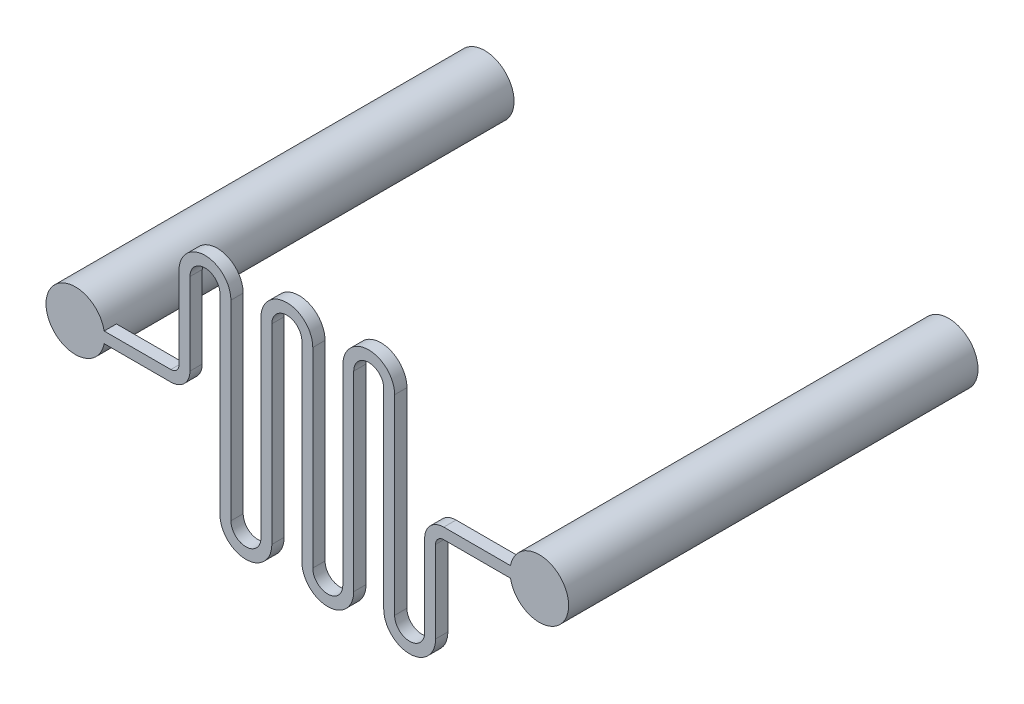
from build123d import *

# Parameters (mm, degrees)
BOSS_EXTRUDE1_DEPTH = 0.9
SKETCH3_W           = 2.15
SKETCH3_H           = 30
SKETCH4_W           = 2.15
SKETCH4_H           = 30
SKETCH5_R           = 1.75
CUT_EXTRUDE1_DEPTH  = 29


with BuildPart() as part:
    # Sketch2 → Boss-Extrude1 (new body)
    with BuildSketch(Plane.XY):
        with BuildLine():
            Line((-20.5, -0.4), (-13.5, -0.4))
            ThreePointArc((-13.5, -0.4), (-12.510050506, 0.010050506), (-12.1, 1))
            Line((-12.1, 1), (-12.1, 7))
            ThreePointArc((-12.1, 7), (-11, 8.1), (-9.9, 7))
            Line((-9.9, 7), (-9.9, 0))
            Line((-9.9, 0), (-9.9, -7))
            ThreePointArc((-9.9, -7), (-8, -8.9), (-6.1, -7))
            Line((-6.1, -7), (-6.1, 0))
            Line((-6.1, 0), (-6.1, 7))
            ThreePointArc((-6.1, 7), (-5, 8.1), (-3.9, 7))
            Line((-3.9, 7), (-3.9, 0))
            Line((-3.9, 0), (-3.9, -7))
            ThreePointArc((-3.9, -7), (-2, -8.9), (-0.1, -7))
            Line((-0.1, -7), (-0.1, 0))
            Line((-0.1, 0), (-0.1, 7))
            ThreePointArc((-0.1, 7), (1, 8.1), (2.1, 7))
            Line((2.1, 7), (2.1, 0))
            Line((2.1, 0), (2.1, -7))
            ThreePointArc((2.1, -7), (4, -8.9), (5.9, -7))
            Line((5.9, -7), (5.9, -1))
            ThreePointArc((5.9, -1), (6.075735931, -0.575735931), (6.5, -0.4))
            Line((6.5, -0.4), (13.5, -0.4))
            ThreePointArc((13.5, -0.4), (13.9, 0), (13.5, 0.4))
            Line((13.5, 0.4), (6.5, 0.4))
            ThreePointArc((6.5, 0.4), (5.510050506, -0.010050506), (5.1, -1))
            Line((5.1, -1), (5.1, -7))
            ThreePointArc((5.1, -7), (4, -8.1), (2.9, -7))
            Line((2.9, -7), (2.9, 0))
            Line((2.9, 0), (2.9, 7))
            ThreePointArc((2.9, 7), (1, 8.9), (-0.9, 7))
            Line((-0.9, 7), (-0.9, 0))
            Line((-0.9, 0), (-0.9, -7))
            ThreePointArc((-0.9, -7), (-2, -8.1), (-3.1, -7))
            Line((-3.1, -7), (-3.1, 0))
            Line((-3.1, 0), (-3.1, 7))
            ThreePointArc((-3.1, 7), (-5, 8.9), (-6.9, 7))
            Line((-6.9, 7), (-6.9, 0))
            Line((-6.9, 0), (-6.9, -7))
            ThreePointArc((-6.9, -7), (-8, -8.1), (-9.1, -7))
            Line((-9.1, -7), (-9.1, 0))
            Line((-9.1, 0), (-9.1, 7))
            ThreePointArc((-9.1, 7), (-11, 8.9), (-12.9, 7))
            Line((-12.9, 7), (-12.9, 1))
            ThreePointArc((-12.9, 1), (-13.075735931, 0.575735931), (-13.5, 0.4))
            Line((-13.5, 0.4), (-20.5, 0.4))
            ThreePointArc((-20.5, 0.4), (-20.9, 0), (-20.5, -0.4))
        make_face()
    extrude(amount=BOSS_EXTRUDE1_DEPTH)

    # Sketch3 → Revolve1 (revolve)
    with BuildSketch(Plane(origin=(0, 0, 0), x_dir=(1, 0, 0), z_dir=(0, 1, 0)), mode=Mode.PRIVATE) as revolve1_sk:
        with Locations((-21.575, 14.1)):
            Rectangle(SKETCH3_W, SKETCH3_H)
    revolve(revolve1_sk.sketch.rotate(Axis((-20.5, 0, 0.9), (0, 0, -1)), 180), axis=Axis((-20.5, 0, 0.9), (0, 0, -1)))

    # Sketch4 → Revolve2 (revolve)
    with BuildSketch(Plane(origin=(0, 0, 0), x_dir=(1, 0, 0), z_dir=(0, 1, 0))):
        with Locations((14.575, 14.1)):
            Rectangle(SKETCH4_W, SKETCH4_H)
    revolve(axis=Axis((13.5, 0, 0.9), (0, 0, -1)))

    # Sketch5 → Cut-Extrude1 (cut)
    with BuildSketch(Plane(origin=(0, 0, -29.1), x_dir=(-1, 0, 0), z_dir=(0, 0, -1))):
        with Locations((-13.5, 0)):
            Circle(SKETCH5_R)
        with Locations((20.5, 0)):
            Circle(SKETCH5_R)
    extrude(amount=-CUT_EXTRUDE1_DEPTH, mode=Mode.SUBTRACT)


solid = part.part
